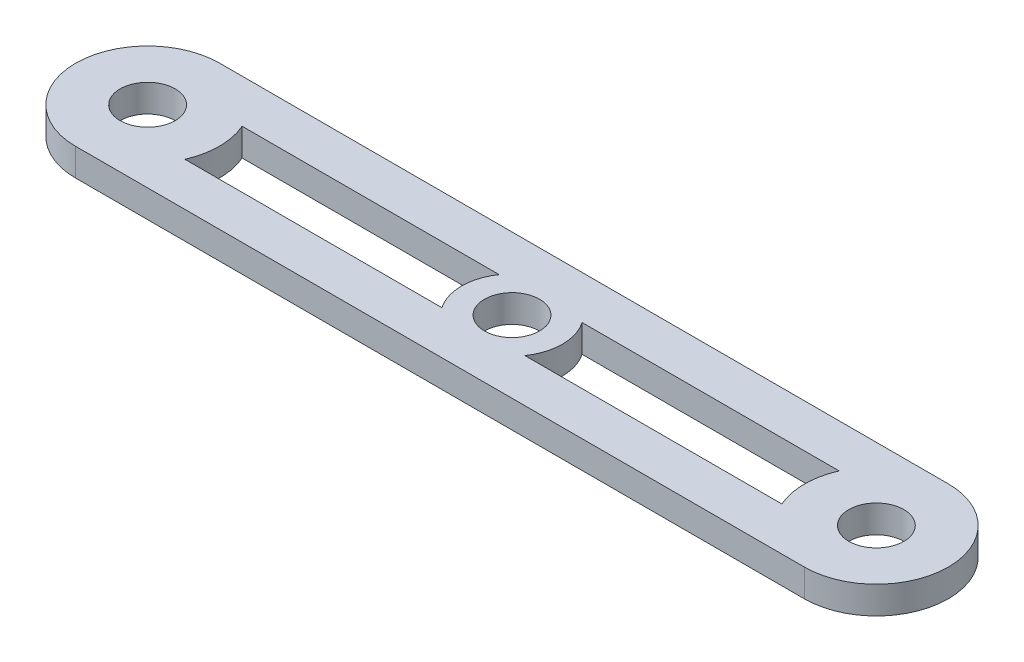
from build123d import *

# Parameters (mm, degrees)
SKETCH1_R           = 1.5875
BOSS_EXTRUDE2_DEPTH = 0.79375


with BuildPart() as part:
    # Sketch1 → Boss-Extrude2 (new, symmetric)
    with BuildSketch(Plane(origin=(0, 0, 0), x_dir=(1, 0, 0), z_dir=(0, 1, 0))):
        with BuildLine():
            Line((21, 4.15), (-21, 4.15))
            ThreePointArc((-21, 4.15), (-25.15, 0), (-21, -4.15))
            Line((-21, -4.15), (21, -4.15))
            ThreePointArc((21, -4.15), (25.15, 0), (21, 4.15))
        make_face()
        with Locations(Location((21, 0, 0), (0, 0, 270))):
            Circle(SKETCH1_R, mode=Mode.SUBTRACT)
        with Locations(Location((-21, 0, 0), (0, 0, 270))):
            Circle(SKETCH1_R, mode=Mode.SUBTRACT)
        with Locations(Location((0, 0, 0), (0, 0, 270))):
            Circle(SKETCH1_R, mode=Mode.SUBTRACT)
        with BuildLine():
            Line((17.202806092, 1.65), (2.390587638, 1.65))
            ThreePointArc((2.390587638, 1.65), (2.904721889, 0), (2.390587638, -1.65))
            Line((2.390587638, -1.65), (17.202806092, -1.65))
            ThreePointArc((17.202806092, -1.65), (16.859808992, 0), (17.202806092, 1.65))
        make_face(mode=Mode.SUBTRACT)
        with BuildLine():
            Line((-17.202806092, -1.65), (-2.390587638, -1.65))
            ThreePointArc((-2.390587638, -1.65), (-2.904721889, 0), (-2.390587638, 1.65))
            Line((-2.390587638, 1.65), (-17.202806092, 1.65))
            ThreePointArc((-17.202806092, 1.65), (-16.859808992, 0), (-17.202806092, -1.65))
        make_face(mode=Mode.SUBTRACT)
    extrude(amount=BOSS_EXTRUDE2_DEPTH, both=True)


solid = part.part
